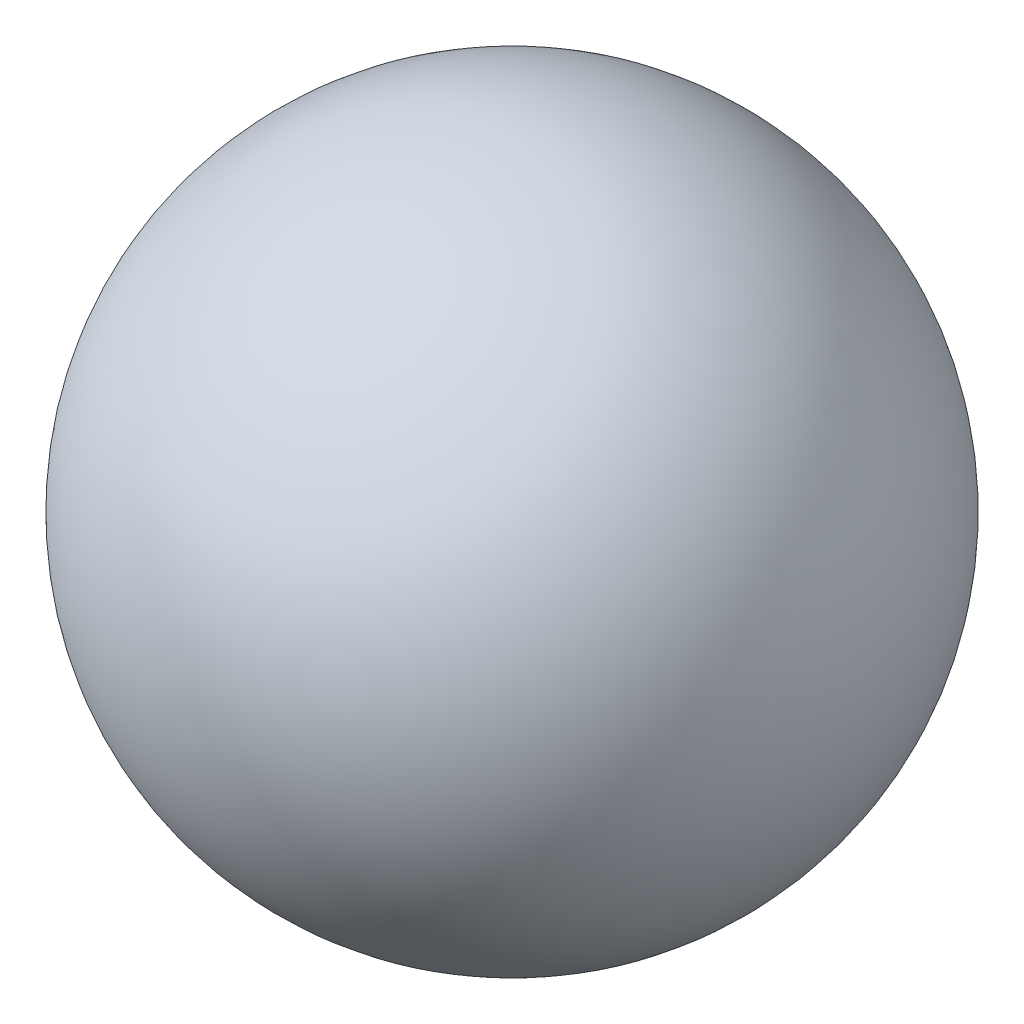
from build123d import *


with BuildPart() as part:
    # Sketch1 → Revolve1 (revolve)
    with BuildSketch(Plane.XY):
        with BuildLine():
            Line((0, 30.1625), (0, -30.1625))
            ThreePointArc((0, -30.1625), (-30.1625, 0), (0, 30.1625))
        make_face()
    revolve(axis=Axis((0, 30.1625, 0), (0, -1, 0)))


solid = part.part
